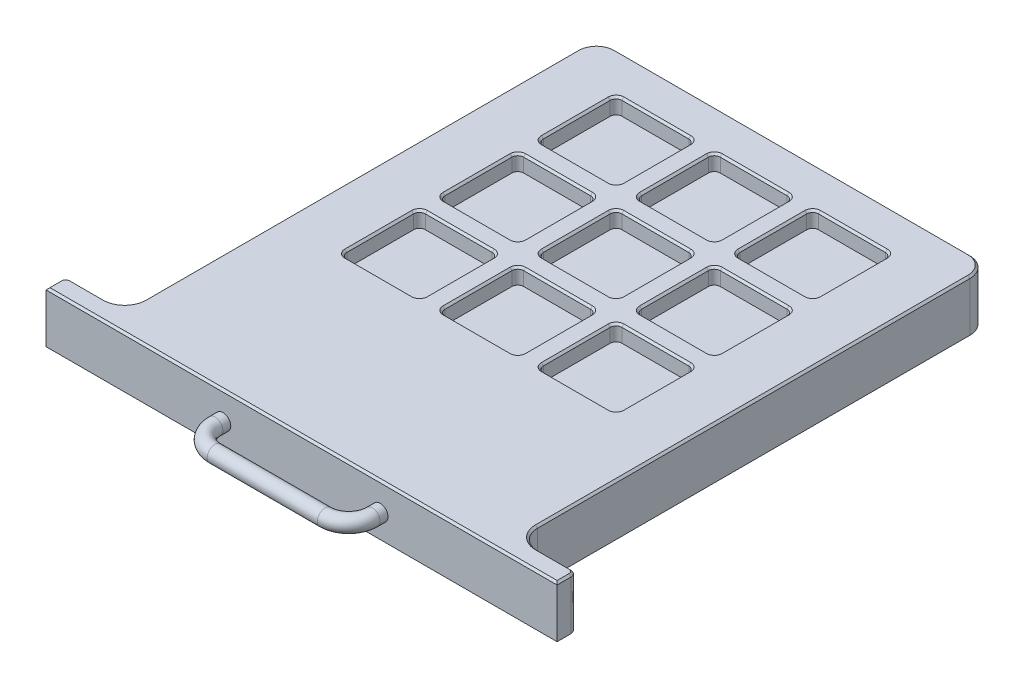
from build123d import *

# Parameters (mm, degrees)
EXTRUDE_1_DEPTH             = 26
CUT_EXTRUDE_3_DEPTH         = 8
PATTERN_LINEAR_3_COUNT      = 3
PATTERN_LINEAR_3_PITCH      = 50
PATTERN_LINEAR_3_COUNT_DIR2 = 3
PATTERN_LINEAR_3_PITCH_DIR2 = 50
CHAMFER_3_SIZE              = 1
SKETCH_5_R                  = 4


with BuildPart() as part:
    # 草图1 → 凸台-拉伸1 (new body)
    with BuildSketch(Plane(origin=(0, 0, 0), x_dir=(1, 0, 0), z_dir=(0, 1, 0))):
        with BuildLine():
            Line((-90, 250), (90, 250))
            ThreePointArc((90, 250), (97.071067812, 247.071067812), (100, 240))
            Line((100, 240), (100, 20))
            ThreePointArc((100, 20), (102.928932188, 12.928932188), (110, 10))
            Line((110, 10), (127, 10))
            ThreePointArc((127, 10), (129.121320344, 9.121320344), (130, 7))
            Line((130, 7), (130, 0))
            Line((130, 0), (-130, 0))
            Line((-130, 0), (-130, 7))
            ThreePointArc((-130, 7), (-129.121320344, 9.121320344), (-127, 10))
            Line((-127, 10), (-110, 10))
            ThreePointArc((-110, 10), (-102.928932188, 12.928932188), (-100, 20))
            Line((-100, 20), (-100, 240))
            ThreePointArc((-100, 240), (-97.071067812, 247.071067812), (-90, 250))
        make_face()
    extrude(amount=EXTRUDE_1_DEPTH)

    # 草图3 → 切除-拉伸3 (cut)
    with BuildSketch(Plane(origin=(0, 26, 0), x_dir=(1, 0, 0), z_dir=(0, 1, 0))):
        with BuildLine():
            Line((-67, 230), (-33, 230))
            ThreePointArc((-33, 230), (-30.878679656, 229.121320344), (-30, 227))
            Line((-30, 227), (-30, 193))
            ThreePointArc((-30, 193), (-30.878679656, 190.878679656), (-33, 190))
            Line((-33, 190), (-67, 190))
            ThreePointArc((-67, 190), (-69.121320344, 190.878679656), (-70, 193))
            Line((-70, 193), (-70, 227))
            ThreePointArc((-70, 227), (-69.121320344, 229.121320344), (-67, 230))
        make_face()
    cut_extrude_3 = extrude(amount=-CUT_EXTRUDE_3_DEPTH, mode=Mode.SUBTRACT)

    # 阵列(线性)3: Cut-Extrude 3 3 × 3
    with Locations(*[(i * PATTERN_LINEAR_3_PITCH, 0, j * PATTERN_LINEAR_3_PITCH_DIR2) for i in range(PATTERN_LINEAR_3_COUNT) for j in range(PATTERN_LINEAR_3_COUNT_DIR2) if (i, j) != (0, 0)]):
        add(cut_extrude_3, mode=Mode.SUBTRACT)

    # 倒角3
    chamfer_3_edges = [part.edges().sort_by_distance(p)[0] for p in [
        (-30.878679656, 26, -140.878679656),
        (-50, 26, -140),
        (-69.121320344, 26, -140.878679656),
        (-70, 26, -160),
        (-69.121320344, 26, -179.121320344),
        (-50, 26, -180),
        (-30.878679656, 26, -179.121320344),
        (-30, 26, -160),
        (19.121320344, 26, -140.878679656),
        (0, 26, -140),
        (-19.121320344, 26, -140.878679656),
        (-20, 26, -160),
        (-19.121320344, 26, -179.121320344),
        (0, 26, -180),
        (19.121320344, 26, -179.121320344),
        (20, 26, -160),
        (97.071067812, 26, -247.071067812),
        (69.121320344, 26, -140.878679656),
        (50, 26, -140),
        (30.878679656, 26, -140.878679656),
        (30, 26, -160),
        (30.878679656, 26, -179.121320344),
        (50, 26, -180),
        (69.121320344, 26, -179.121320344),
        (70, 26, -160),
        (-30.878679656, 26, -90.878679656),
        (-50, 26, -90),
        (-69.121320344, 26, -90.878679656),
        (-70, 26, -110),
        (-69.121320344, 26, -129.121320344),
        (-50, 26, -130),
        (-30.878679656, 26, -129.121320344),
        (-30, 26, -110),
        (0, 26, -250),
        (19.121320344, 26, -90.878679656),
        (0, 26, -90),
        (-19.121320344, 26, -90.878679656),
        (-20, 26, -110),
        (-19.121320344, 26, -129.121320344),
        (0, 26, -130),
        (19.121320344, 26, -129.121320344),
        (20, 26, -110),
        (69.121320344, 26, -90.878679656),
        (50, 26, -90),
        (30.878679656, 26, -90.878679656),
        (30, 26, -110),
        (30.878679656, 26, -129.121320344),
        (50, 26, -130),
        (69.121320344, 26, -129.121320344),
        (70, 26, -110),
        (-97.071067812, 26, -247.071067812),
        (-100, 26, -130),
        (-102.928932188, 26, -12.928932188),
        (-118.5, 26, -10),
        (-129.121320344, 26, -9.121320344),
        (-130, 26, -3.5),
        (0, 26, 0),
        (-30.878679656, 26, -190.878679656),
        (-30, 26, -210),
        (-30.878679656, 26, -229.121320344),
        (130, 26, -3.5),
        (-50, 26, -230),
        (-69.121320344, 26, -229.121320344),
        (-70, 26, -210),
        (-69.121320344, 26, -190.878679656),
        (102.928932188, 26, -12.928932188),
        (-50, 26, -190),
        (129.121320344, 26, -9.121320344),
        (118.5, 26, -10),
        (19.121320344, 26, -190.878679656),
        (20, 26, -210),
        (19.121320344, 26, -229.121320344),
        (0, 26, -230),
        (-19.121320344, 26, -229.121320344),
        (-20, 26, -210),
        (-19.121320344, 26, -190.878679656),
        (0, 26, -190),
        (69.121320344, 26, -190.878679656),
        (50, 26, -190),
        (30.878679656, 26, -190.878679656),
        (30, 26, -210),
        (30.878679656, 26, -229.121320344),
        (50, 26, -230),
        (69.121320344, 26, -229.121320344),
        (70, 26, -210),
        (100, 26, -130),
    ]]
    chamfer(chamfer_3_edges, length=CHAMFER_3_SIZE)

    # 扫描1: sweep along a path in 草图4
    with BuildLine(Plane(origin=(0, 12, 0), x_dir=(-1, 0, 0), z_dir=(0, -1, 0))) as sweep_1_path:
        Line((-40, 0), (-40, -4))
        ThreePointArc((-40, -4), (-36.485281374, -12.485281374), (-28, -16))
        Line((-28, -16), (28, -16))
        ThreePointArc((28, -16), (36.485281374, -12.485281374), (40, -4))
        Line((40, -4), (40, 0))
    # 草图5 → 扫描1 (sweep)
    with BuildSketch(Plane.XY):
        with Locations((-40, 12)):
            Circle(SKETCH_5_R)
    sweep(path=sweep_1_path.line)


solid = part.part
